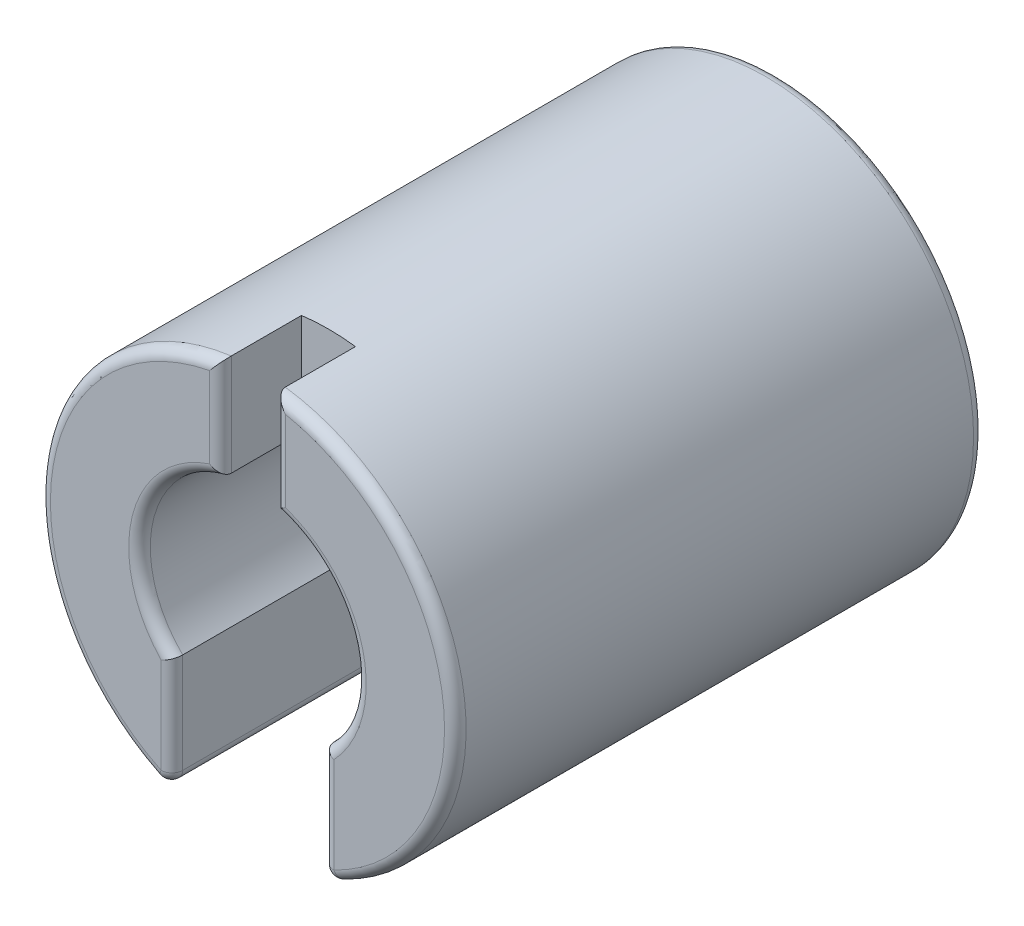
from build123d import *

# Parameters (mm, degrees)
EXTRUDE_1_DEPTH     = 9.8
CUT_EXTRUDE_START   = -1.5
CUT_EXTRUDE_1_DEPTH = 1.5
CUT_EXTRUDE_2_DEPTH = 1.5
CUT_EXTRUDE_3_DEPTH = 12.210932165
FILLET_1_R          = 0.2


with BuildPart() as part:
    # 草图1 → 凸台-拉伸1 (new body)
    with BuildSketch(Plane.XY):
        with BuildLine():
            Line((-1.4, -3.586432768), (-1.4, -1.428285686))
            ThreePointArc((-1.4, -1.428285686), (0, 2), (1.4, -1.428285686))
            Line((1.4, -1.428285686), (1.4, -3.586432768))
            ThreePointArc((1.4, -3.586432768), (0, 3.85), (-1.4, -3.586432768))
        make_face()
    extrude(amount=EXTRUDE_1_DEPTH)

    # 草图2 → 切除-拉伸1 (cut)
    with BuildSketch(Plane.XY.offset(9.8).offset(CUT_EXTRUDE_START)):
        with BuildLine():
            Line((-0.5, 1.936491673), (-0.5, 3.817394399))
            ThreePointArc((-0.5, 3.817394399), (0, 3.85), (0.5, 3.817394399))
            Line((0.5, 3.817394399), (0.5, 1.936491673))
            ThreePointArc((0.5, 1.936491673), (0, 2), (-0.5, 1.936491673))
        make_face()
    extrude(amount=CUT_EXTRUDE_1_DEPTH, mode=Mode.SUBTRACT)

    # 草图3 → 切除-拉伸2 (cut)
    with BuildSketch(Plane(origin=(0, 0, 0), x_dir=(-1, 0, 0), z_dir=(0, 0, -1))):
        with BuildLine():
            Line((-1.767766953, -1.767766953), (-2.474873734, -2.474873734))
            ThreePointArc((-2.474873734, -2.474873734), (0, 3.5), (2.474873734, -2.474873734))
            Line((2.474873734, -2.474873734), (1.767766953, -1.767766953))
            ThreePointArc((1.767766953, -1.767766953), (0, 2.5), (-1.767766953, -1.767766953))
        make_face()
    extrude(amount=-CUT_EXTRUDE_2_DEPTH, mode=Mode.SUBTRACT)

    # 草图4 → 切除-拉伸3 (cut, through all)
    with BuildSketch(Plane(origin=(0, 0, 0), x_dir=(-1, 0, 0), z_dir=(0, 0, -1))):
        with BuildLine():
            Line((-0.5, 1.936491673), (-0.5, 2.244994432))
            ThreePointArc((-0.5, 2.244994432), (0, 2.3), (0.5, 2.244994432))
            Line((0.5, 2.244994432), (0.5, 1.936491673))
            ThreePointArc((0.5, 1.936491673), (0, 2), (-0.5, 1.936491673))
        make_face()
    extrude(amount=-CUT_EXTRUDE_3_DEPTH, mode=Mode.SUBTRACT)

    # 圆角1
    fillet_1_edges = [part.edges().sort_by_distance(p)[0] for p in [
        (-1.932079623, 0.516786543, 9.8),
        (1.4, -2.507359227, 9.8),
        (-3.821866583, 0.464581337, 9.8),
        (1.932079623, 0.516786543, 9.8),
        (0.5, 2.876943036, 9.8),
        (-0.5, 2.876943036, 9.8),
        (3.821866583, 0.464581337, 9.8),
        (0, 3.85, 0),
        (-1.4, -2.507359227, 9.8),
        (1.4, -3.586432768, 4.9),
        (-1.4, -3.586432768, 4.9),
    ]]
    fillet(fillet_1_edges, radius=FILLET_1_R)


solid = part.part
